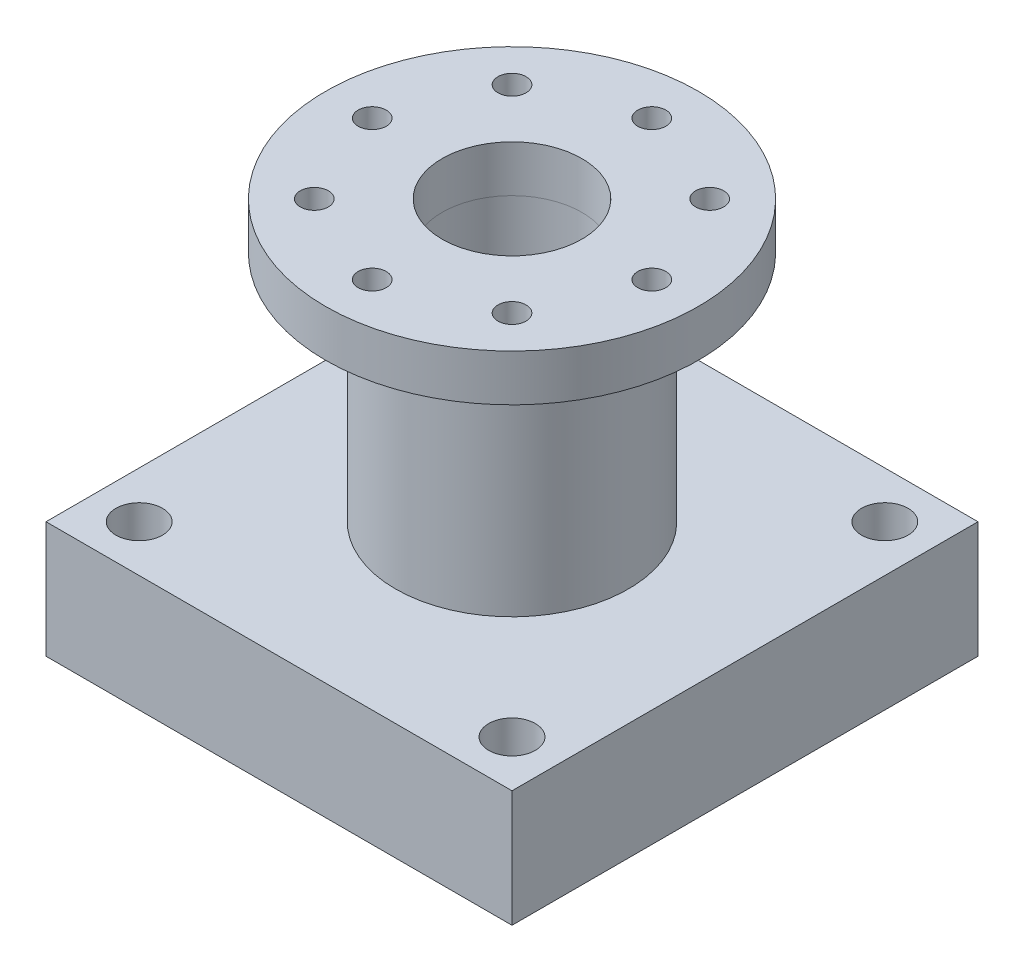
from build123d import *

# Parameters (mm, degrees)
SKETCH1_W            = 100
SKETCH1_H            = 100
BOSS_EXTRUDE1_DEPTH  = 25
SKETCH2_R            = 25
SKETCH2_R_2          = 15
BOSS_EXTRUDE2_DEPTH  = 50
SKETCH3_R            = 40
SKETCH3_R_2          = 15
BOSS_EXTRUDE3_DEPTH  = 10
SKETCH4_R            = 3.014352333
CUT_EXTRUDE1_DEPTH   = 10
CIRPATTERN1_COUNT    = 8
SKETCH5_R            = 5
CUT_EXTRUDE2_DEPTH   = 25
LPATTERN1_COUNT      = 2
LPATTERN1_PITCH      = 80
LPATTERN1_COUNT_DIR2 = 2
LPATTERN1_PITCH_DIR2 = 80


with BuildPart() as part:
    # Sketch1 → Boss-Extrude1 (new body)
    with BuildSketch(Plane(origin=(0, 0, 0), x_dir=(1, 0, 0), z_dir=(0, 1, 0))):
        Rectangle(SKETCH1_W, SKETCH1_H)
    extrude(amount=-BOSS_EXTRUDE1_DEPTH)

    # Sketch2 → Boss-Extrude2 (add)
    with BuildSketch(Plane(origin=(0, 0, 0), x_dir=(1, 0, 0), z_dir=(0, 1, 0))):
        with Locations(Location((0, 0, 0), (0, 0, 90))):
            Circle(SKETCH2_R)
        with Locations(Location((0, 0, 0), (0, 0, 270))):
            Circle(SKETCH2_R_2, mode=Mode.SUBTRACT)
    extrude(amount=BOSS_EXTRUDE2_DEPTH)

    # Sketch5 → Cut-Extrude2 (cut)
    with BuildSketch(Plane.XZ.offset(25)):
        with Locations(Location((-40, 40, 0), (0, 0, 270))):
            Circle(SKETCH5_R)
    cut_extrude2 = extrude(amount=-CUT_EXTRUDE2_DEPTH, mode=Mode.SUBTRACT)

    # LPattern1: Cut-Extrude2 2 × 2
    with Locations(*[(j * LPATTERN1_PITCH_DIR2, 0, -i * LPATTERN1_PITCH) for i in range(LPATTERN1_COUNT) for j in range(LPATTERN1_COUNT_DIR2) if (i, j) != (0, 0)]):
        add(cut_extrude2, mode=Mode.SUBTRACT)


with BuildPart() as body_2:
    # Sketch3 → Boss-Extrude3 (new body)
    with BuildSketch(Plane(origin=(0, 50, 0), x_dir=(1, 0, 0), z_dir=(0, 1, 0))):
        with Locations(Location((0, 0, 0), (0, 0, 270))):
            Circle(SKETCH3_R)
        with Locations(Location((0, 0, 0), (0, 0, 270))):
            Circle(SKETCH3_R_2, mode=Mode.SUBTRACT)
    extrude(amount=BOSS_EXTRUDE3_DEPTH)

    # Sketch4 → Cut-Extrude1 (cut)
    with BuildSketch(Plane(origin=(0, 60, 0), x_dir=(1, 0, 0), z_dir=(0, 1, 0))):
        with Locations(Location((0, 30, 0), (0, 0, 270))):
            Circle(SKETCH4_R)
    cut_extrude1 = extrude(amount=-CUT_EXTRUDE1_DEPTH, mode=Mode.SUBTRACT)

    # CirPattern1: Cut-Extrude1 ×8 about axis
    cirpattern1_axis = Axis((0, 0, 0), (0, 1, 0))
    for i in range(1, CIRPATTERN1_COUNT):
        add(cut_extrude1.rotate(cirpattern1_axis, i * 360 / CIRPATTERN1_COUNT), mode=Mode.SUBTRACT)


solid = Compound([part.part, body_2.part])
